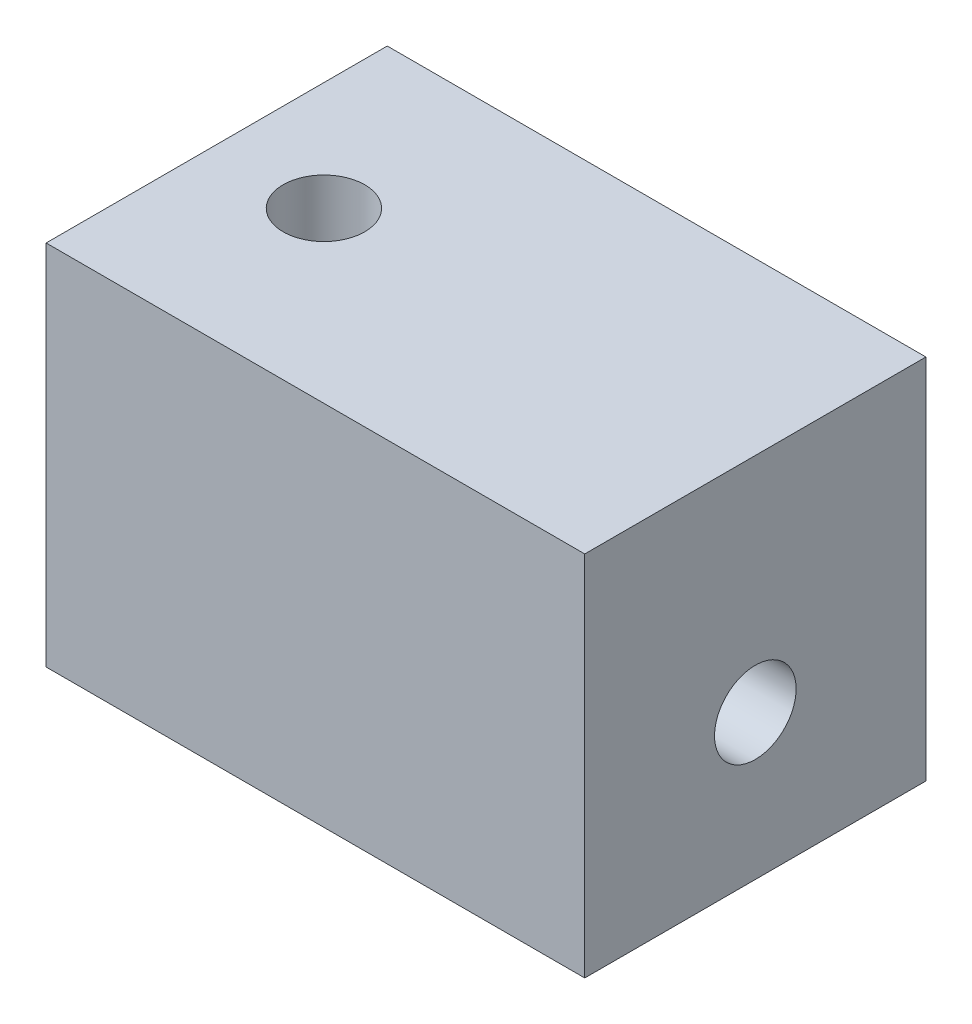
from build123d import *

# Parameters (mm, degrees)
BOSS_EXTRUDE1_DEPTH = 12.9
SKETCH2_R           = 2.5
CUT_EXTRUDE1_DEPTH  = 38.288201887
SKETCH3_R           = 2.5
CUT_EXTRUDE2_DEPTH  = 38.288201887
SKETCH5_W           = 36
SKETCH5_H           = 24
BOSS_EXTRUDE3_DEPTH = 4
SKETCH6_W           = 17.3
SKETCH6_H           = 5.3
BOSS_EXTRUDE4_DEPTH = 12.9
SKETCH7_R           = 2.5
CUT_EXTRUDE3_DEPTH  = 40.182904435
EXTRUDE_3_DEPTH     = 4
SKETCH_5_W          = 3
SKETCH_5_H          = 20.9
CUT_EXTRUDE_1_DEPTH = 42.971537975
CUT_EXTRUDE_2_DEPTH = 4
SKETCH_7_W          = 16.9
SKETCH_7_H          = 1.5
CUT_EXTRUDE_3_DEPTH = 20
CUT_EXTRUDE5_REACH  = 40.998
SKETCH8_W           = 1.3
SKETCH8_H           = 12.9
SKETCH_9_W          = 4
SKETCH_9_H          = 24
CUT_EXTRUDE_4_DEPTH = 42.214196583
SKETCH_11_W         = 16.9
SKETCH_11_H         = 1.5
CUT_EXTRUDE_6_DEPTH = 32.774360733
SKETCH_13_W         = 12.9
SKETCH_13_H         = 3.8
EXTRUDE_5_DEPTH     = 1.3
EXTRUDE_6_DEPTH     = 4


with BuildPart() as part:
    # Sketch1 → Boss-Extrude1 (new body)
    with BuildSketch(Plane.XY):
        Polygon((-30, 0), (-30, 6), (6, 6), (6, -18), (0, -18), (0, 0), align=None)
    extrude(amount=BOSS_EXTRUDE1_DEPTH)

    # Sketch2 → Cut-Extrude1 (cut, through all)
    with BuildSketch(Plane.XZ):
        with Locations(Location((-20.33, 6.55, 0), (0, 0, 270))):
            Circle(SKETCH2_R)
    extrude(amount=-CUT_EXTRUDE1_DEPTH, mode=Mode.SUBTRACT)

    # Sketch3 → Cut-Extrude2 (cut, through all)
    with BuildSketch(Plane.ZY):
        with Locations(Location((6.45, -7.63, 0), (0, 0, 270))):
            Circle(SKETCH3_R)
    extrude(amount=-CUT_EXTRUDE2_DEPTH, mode=Mode.SUBTRACT)

    # Sketch5 → Boss-Extrude3 (add)
    with BuildSketch(Plane.XY.offset(12.9)):
        with Locations((-12, -6)):
            Rectangle(SKETCH5_W, SKETCH5_H)
    extrude(amount=BOSS_EXTRUDE3_DEPTH)

    # Sketch6 → Boss-Extrude4 (add)
    with BuildSketch(Plane(origin=(0, 0, 12.9), x_dir=(-1, 0, 0), z_dir=(0, 0, -1))):
        with Locations((21.35, -15.35)):
            Rectangle(SKETCH6_W, SKETCH6_H)
    extrude(amount=BOSS_EXTRUDE4_DEPTH)

    # Sketch7 → Cut-Extrude3 (cut, through all)
    with BuildSketch(Plane(origin=(0, -12.7, 0), x_dir=(1, 0, 0), z_dir=(0, 1, 0))):
        with Locations(Location((-20.33, -6.45, 0), (0, 0, 180))):
            Circle(SKETCH7_R)
    extrude(amount=-CUT_EXTRUDE3_DEPTH, mode=Mode.SUBTRACT)

    # 草图4 → 凸台-拉伸3 (add)
    with BuildSketch(Plane(origin=(0, 0, 0), x_dir=(-1, 0, 0), z_dir=(0, 0, -1))):
        Polygon((30, 6), (9, 6), (9, -4), (11, -4), (11, -18), (30, -18), align=None)
    extrude(amount=EXTRUDE_3_DEPTH)

    # 草图5 → 切除-拉伸1 (cut, through all)
    with BuildSketch(Plane.XZ.offset(18)):
        with Locations((-28.5, 6.45)):
            Rectangle(SKETCH_5_W, SKETCH_5_H)
    extrude(amount=-CUT_EXTRUDE_1_DEPTH, mode=Mode.SUBTRACT)

    # 草图6 → 切除-拉伸2 (cut)
    with BuildSketch(Plane(origin=(0, 0, -4), x_dir=(-1, 0, 0), z_dir=(0, 0, -1))):
        Polygon((11, -18), (11, -14), (13.1, -18), align=None)
    extrude(amount=-CUT_EXTRUDE_2_DEPTH, mode=Mode.SUBTRACT)

    # 草图7 → 切除-拉伸3 (cut)
    with BuildSketch(Plane(origin=(6, 0, 0), x_dir=(0, 0, -1), z_dir=(1, 0, 0))):
        with Locations((-8.45, -17.25)):
            Rectangle(SKETCH_7_W, SKETCH_7_H)
    extrude(amount=-CUT_EXTRUDE_3_DEPTH, mode=Mode.SUBTRACT)

    # Sketch8 → Cut-Extrude5 (cut, up to next)
    with BuildSketch(Plane.XZ.offset(16.5), mode=Mode.PRIVATE) as cut_extrude5_sk1:
        with Locations((-13.35, 6.45)):
            Rectangle(SKETCH8_W, SKETCH8_H)
    cut_extrude5_tool1 = extrude(cut_extrude5_sk1.sketch, amount=-CUT_EXTRUDE5_REACH, mode=Mode.PRIVATE) & part.part
    add(cut_extrude5_tool1.solids().sort_by_distance((-13.35, -16.5, 6.45))[0], mode=Mode.SUBTRACT)

    # 草图9 → 切除-拉伸4 (cut, through all)
    with BuildSketch(Plane(origin=(6, 0, 0), x_dir=(0, 0, -1), z_dir=(1, 0, 0))):
        with Locations((2, -6)):
            Rectangle(SKETCH_9_W, SKETCH_9_H)
    extrude(amount=-CUT_EXTRUDE_4_DEPTH, mode=Mode.SUBTRACT)

    # 草图11 → 切除-拉伸6 (cut, through all)
    with BuildSketch(Plane(origin=(-14, 0, 0), x_dir=(0, 0, -1), z_dir=(1, 0, 0))):
        with Locations((-8.45, -17.25)):
            Rectangle(SKETCH_11_W, SKETCH_11_H)
    extrude(amount=-CUT_EXTRUDE_6_DEPTH, mode=Mode.SUBTRACT)

    # 草图13 → 凸台-拉伸5 (add)
    with BuildSketch(Plane(origin=(-14, 0, 0), x_dir=(0, 0, -1), z_dir=(1, 0, 0))):
        with Locations((-6.45, -14.6)):
            Rectangle(SKETCH_13_W, SKETCH_13_H)
    extrude(amount=EXTRUDE_5_DEPTH)

    # 草图17 → 凸台-拉伸6 (add)
    with BuildSketch(Plane(origin=(0, 0, 0), x_dir=(-1, 0, 0), z_dir=(0, 0, -1))):
        Polygon((27, 6), (-6, 6), (-6, -16.5), (0, -16.5), (0, -3.5), (12.7, -3.5), (12.7, -16.5), (27, -16.5), (27, -12.7), (16.2, -12.7), (16.2, 0), (27, 0), align=None)
    extrude(amount=EXTRUDE_6_DEPTH)


solid = part.part
